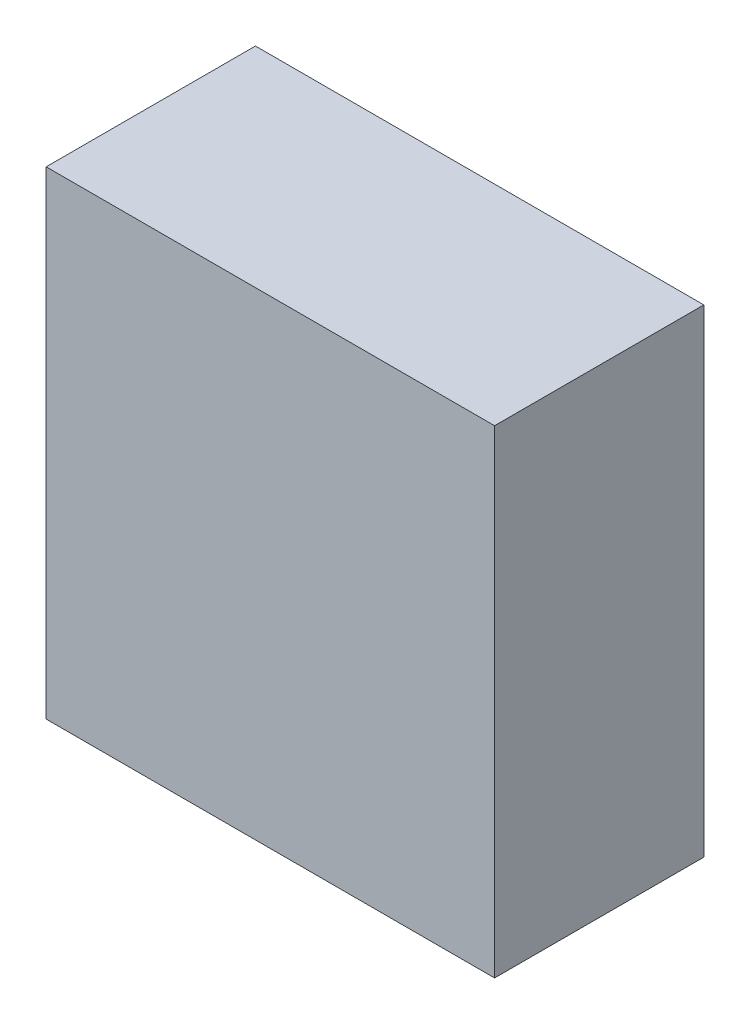
from build123d import *

# Parameters (mm, degrees)
SKETCH1_W           = 30
SKETCH1_H           = 32
BOSS_EXTRUDE1_DEPTH = 14


with BuildPart() as part:
    # Sketch1 → Boss-Extrude1 (new body)
    with BuildSketch(Plane.XY):
        with Locations((-15, 16)):
            Rectangle(SKETCH1_W, SKETCH1_H)
    extrude(amount=BOSS_EXTRUDE1_DEPTH)


solid = part.part
